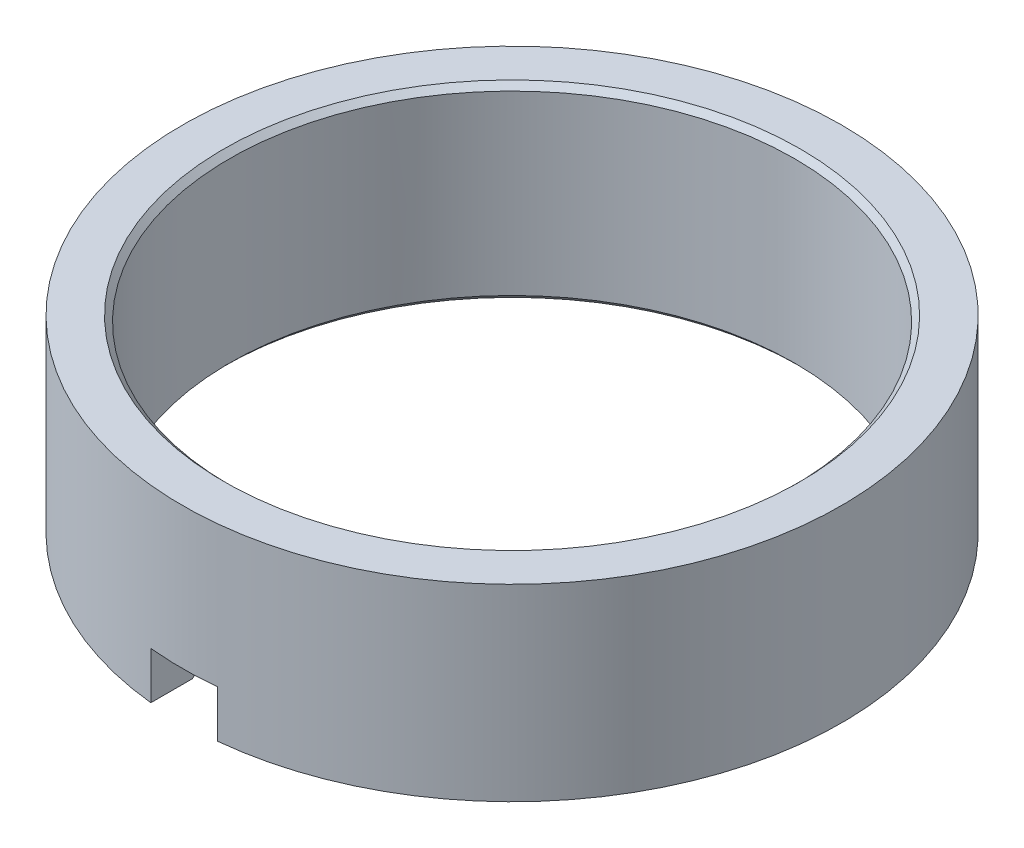
from build123d import *

# Parameters (mm, degrees)
SKETCH1_W          = 76.2
SKETCH1_H          = 19.0246
CHAMFER1_SIZE      = 2.286
CUT_EXTRUDE2_START = -38.1
SKETCH2_W          = 26.9748
SKETCH2_H          = 266.7
CUT_EXTRUDE2_DEPTH = 19.05


with BuildPart() as part:
    # Sketch1 → Revolve1 (revolve)
    with BuildSketch(Plane(origin=(0, 0, 0), x_dir=(0, 1, 0), z_dir=(0, 0, 1)), mode=Mode.PRIVATE) as revolve1_sk:
        with Locations((0, 123.8377)):
            Rectangle(SKETCH1_W, SKETCH1_H)
    revolve(revolve1_sk.sketch.rotate(Axis((0, -63.5, 0), (0, 1, 0)), 270), axis=Axis((0, -63.5, 0), (0, 1, 0)))

    # Chamfer1
    chamfer1_edges = [part.edges().sort_by_distance(p)[0] for p in [
        (0, -38.1, 114.3254),
        (0, 38.1, 114.3254),
    ]]
    chamfer(chamfer1_edges, length=CHAMFER1_SIZE)

    # Sketch2 → Cut-Extrude2 (cut)
    with BuildSketch(Plane(origin=(0, 0, 0), x_dir=(-1, 0, 0), z_dir=(0, 1, 0)).offset(CUT_EXTRUDE2_START)):
        with Locations((0, 133.35)):
            Rectangle(SKETCH2_W, SKETCH2_H)
    extrude(amount=CUT_EXTRUDE2_DEPTH, mode=Mode.SUBTRACT)


solid = part.part
